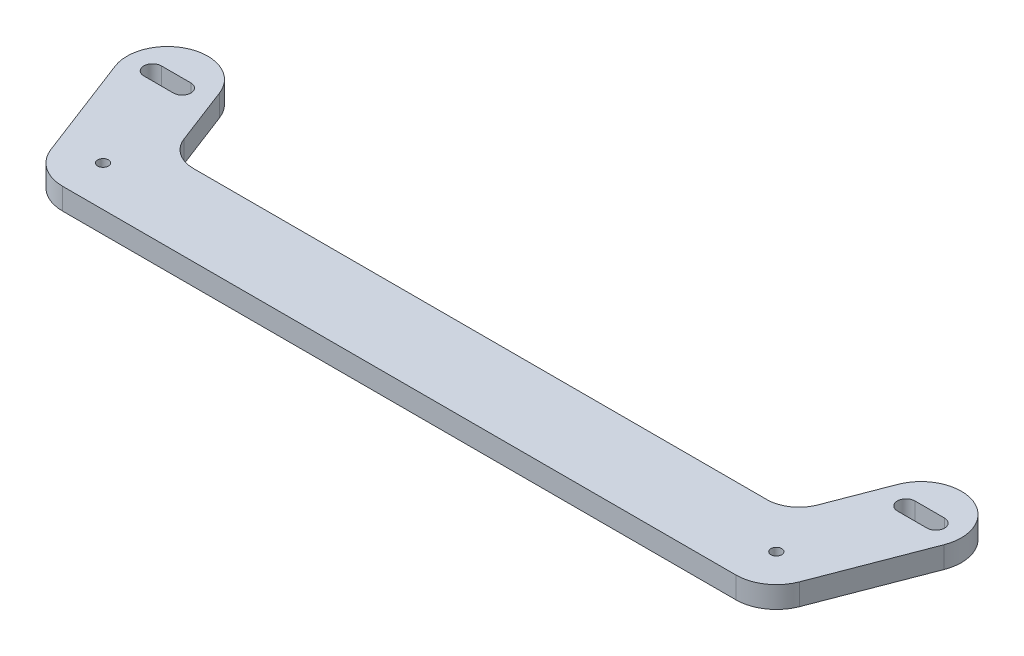
from build123d import *

# Parameters (mm, degrees)
SKETCH1_R           = 2
BOSS_EXTRUDE1_DEPTH = 8


with BuildPart() as part:
    # Sketch1 → Boss-Extrude1 (new body)
    with BuildSketch(Plane(origin=(0, 0, 0), x_dir=(1, 0, 0), z_dir=(0, 1, 0))):
        with BuildLine():
            Line((-125.897027312, 145.777430233), (-117.648504662, 124.298055814))
            ThreePointArc((-117.648504662, 124.298055814), (-113.242326544, 118.710021986), (-106.446126512, 116.6))
            Line((-106.446126512, 116.6), (106.446126512, 116.6))
            ThreePointArc((106.446126512, 116.6), (113.242326544, 118.710021986), (117.648504662, 124.298055814))
            Line((117.648504662, 124.298055814), (125.897027312, 145.777430233))
            ThreePointArc((125.897027312, 145.777430233), (145.277430233, 154.402972688), (153.902972688, 135.022569767))
            Line((153.902972688, 135.022569767), (139.002972688, 96.222569767))
            ThreePointArc((139.002972688, 96.222569767), (133.495250041, 89.237527482), (125, 86.6))
            Line((125, 86.6), (-125, 86.6))
            ThreePointArc((-125, 86.6), (-133.495250041, 89.237527482), (-139.002972688, 96.222569767))
            Line((-139.002972688, 96.222569767), (-153.902972688, 135.022569767))
            ThreePointArc((-153.902972688, 135.022569767), (-145.277430233, 154.402972688), (-125.897027312, 145.777430233))
        make_face()
        with Locations(Location((-125, 101.6, 0), (0, 0, 270))):
            Circle(SKETCH1_R, mode=Mode.SUBTRACT)
        with Locations(Location((125, 101.6, 0), (0, 0, 270))):
            Circle(SKETCH1_R, mode=Mode.SUBTRACT)
        with BuildLine():
            Line((-145.4, 143.65), (-134.4, 143.65))
            ThreePointArc((-134.4, 143.65), (-131.15, 140.4), (-134.4, 137.15))
            Line((-134.4, 137.15), (-145.4, 137.15))
            ThreePointArc((-145.4, 137.15), (-148.65, 140.4), (-145.4, 143.65))
        make_face(mode=Mode.SUBTRACT)
        with BuildLine():
            Line((145.4, 137.15), (134.4, 137.15))
            ThreePointArc((134.4, 137.15), (131.15, 140.4), (134.4, 143.65))
            Line((134.4, 143.65), (145.4, 143.65))
            ThreePointArc((145.4, 143.65), (148.65, 140.4), (145.4, 137.15))
        make_face(mode=Mode.SUBTRACT)
    extrude(amount=BOSS_EXTRUDE1_DEPTH)


solid = part.part
